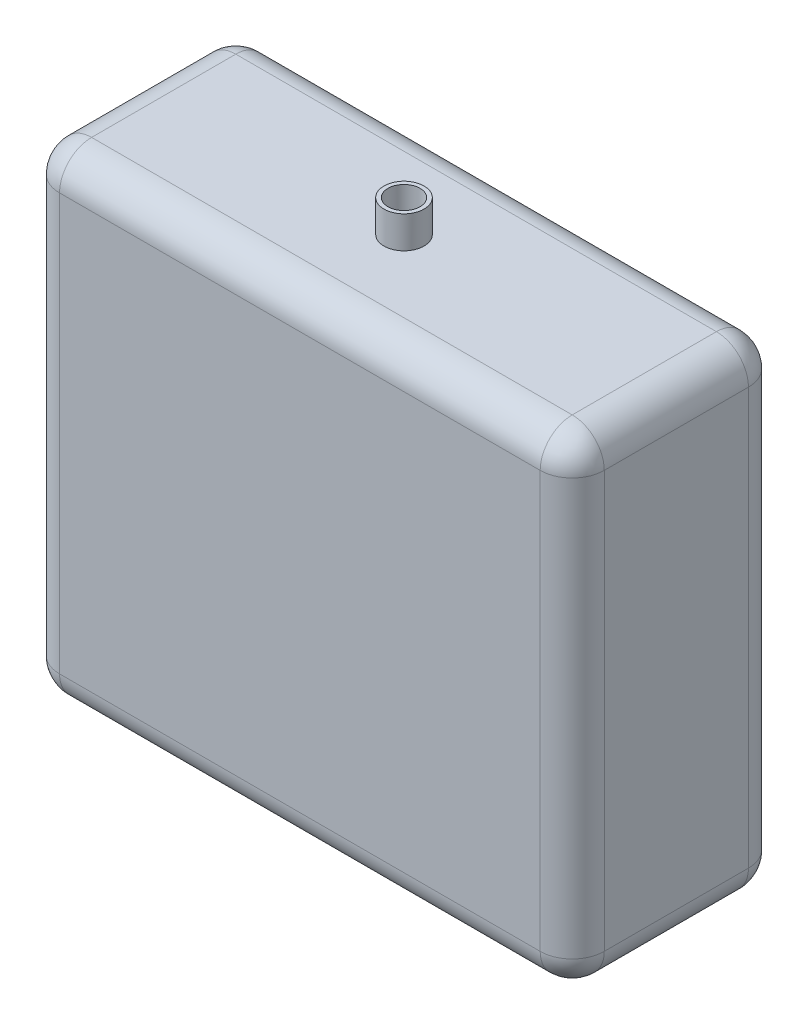
from build123d import *

# Parameters (mm, degrees)
SKETCH1_W           = 340
SKETCH1_H           = 300
BOSS_EXTRUDE1_DEPTH = 130
FILLET1_R           = 20
SKETCH2_R           = 12.5
BOSS_EXTRUDE2_DEPTH = 20
SHELL2_T            = -2.5


with BuildPart() as part:
    # Sketch1 → Boss-Extrude1 (new body)
    with BuildSketch(Plane.XY):
        Rectangle(SKETCH1_W, SKETCH1_H)
    extrude(amount=BOSS_EXTRUDE1_DEPTH)

    # Fillet1
    fillet1_edges = [part.edges().sort_by_distance(p)[0] for p in [
        (-170, 0, 130),
        (0, -150, 130),
        (170, 0, 130),
        (0, -150, 0),
        (-170, 0, 0),
        (0, 150, 0),
        (170, 0, 0),
        (170, -150, 65),
        (-170, -150, 65),
        (-170, 150, 65),
        (170, 150, 65),
        (0, 150, 130),
    ]]
    fillet(fillet1_edges, radius=FILLET1_R)

    # Sketch2 → Boss-Extrude2 (add)
    with BuildSketch(Plane(origin=(0, 150, 0), x_dir=(1, 0, 0), z_dir=(0, 1, 0))):
        with Locations(Location((0, -65, 0), (0, 0, 90))):
            Circle(SKETCH2_R)
    extrude(amount=BOSS_EXTRUDE2_DEPTH)

    # Shell2
    shell2_openings = [part.faces().sort_by_distance(p)[0] for p in [
        (0, 170, 65),
    ]]
    offset(amount=SHELL2_T, openings=shell2_openings, kind=Kind.INTERSECTION)


solid = part.part
